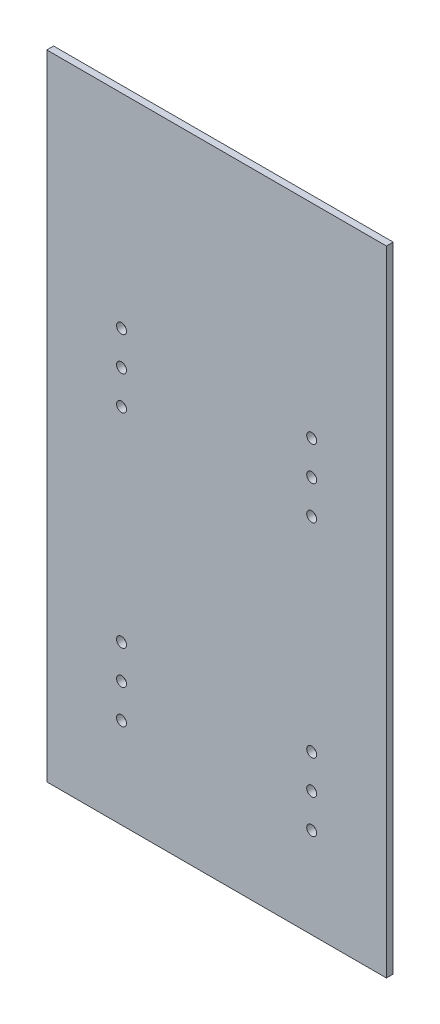
from build123d import *

# Parameters (mm, degrees)
BOSS_EXTRUDE1_DEPTH = 3
F_3DSKETCH2_R       = 2.2
CUT_EXTRUDE1_DEPTH  = 18


with BuildPart() as part:
    # 3DSketch1 → Boss-Extrude1 (new body)
    with BuildSketch(Plane(origin=(296.043137644, 1172.692882005, 0), x_dir=(-0.4722214125154188, -0.8814799700287822, 0), z_dir=(0, 0, 1))):
        Polygon((0, 0), (70.833211877, -132.221995504), (317.647603485, 0), (246.814391608, 132.221995504), align=None)
    extrude(amount=BOSS_EXTRUDE1_DEPTH)

    # 3DSketch2 → Cut-Extrude1 (cut)
    with BuildSketch(Plane(origin=(179.043137644, 1082.692882005, 6), x_dir=(0.48860336893184353, -0.8725060159497199, 0), z_dir=(0, 0, -1))):
        with Locations(Location((0, 0, 0), (0, 0, 119.248826336))):
            Circle(F_3DSKETCH2_R)
        with Locations(Location((13.087590239, 7.329050534, 0), (0, 0, 119.248826336))):
            Circle(F_3DSKETCH2_R)
        with Locations(Location((26.175180478, 14.658101068, 0), (0, 0, 119.248826336))):
            Circle(F_3DSKETCH2_R)
        with Locations(Location((104.700721914, 58.632404272, 0), (0, 0, 119.248826337))):
            Circle(F_3DSKETCH2_R)
        with Locations(Location((117.788312153, 65.961454806, 0), (0, 0, 119.248826337))):
            Circle(F_3DSKETCH2_R)
        with Locations(Location((130.875902392, 73.29050534, 0), (0, 0, 119.248826337))):
            Circle(F_3DSKETCH2_R)
        with Locations(Location((171.918585383, 0, 0), (0, 0, 119.248826337))):
            Circle(F_3DSKETCH2_R)
        with Locations(Location((158.830995143, -7.329050534, 0), (0, 0, 119.248826337))):
            Circle(F_3DSKETCH2_R)
        with Locations(Location((145.743404904, -14.658101068, 0), (0, 0, 119.248826337))):
            Circle(F_3DSKETCH2_R)
        with Locations(Location((67.217863469, -58.632404272, 0), (0, 0, 119.248826336))):
            Circle(F_3DSKETCH2_R)
        with Locations(Location((41.04268299, -73.29050534, 0), (0, 0, 119.248826336))):
            Circle(F_3DSKETCH2_R)
        with Locations(Location((54.13027323, -65.961454806, 0), (0, 0, 119.248826336))):
            Circle(F_3DSKETCH2_R)
    extrude(amount=CUT_EXTRUDE1_DEPTH, mode=Mode.SUBTRACT)


solid = part.part
